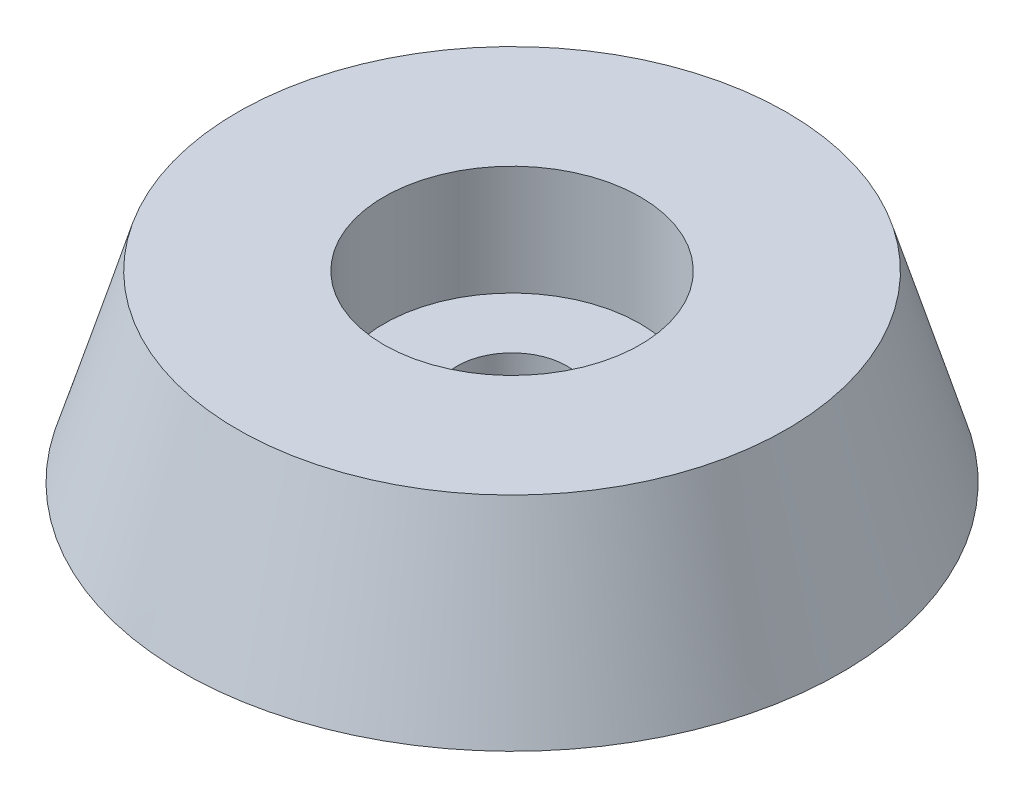
from build123d import *


with BuildPart() as part:
    # Sketch1 → Revolve1 (revolve)
    with BuildSketch(Plane.XY, mode=Mode.PRIVATE) as revolve1_sk:
        Polygon((1.5, 0), (1.5, 2), (3.5, 2), (3.5, 5), (7.5, 5), (9, 0), align=None)
    revolve(revolve1_sk.sketch.rotate(Axis((0, 0, 0), (0, 1, 0)), 90), axis=Axis((0, 0, 0), (0, 1, 0)))


solid = part.part
